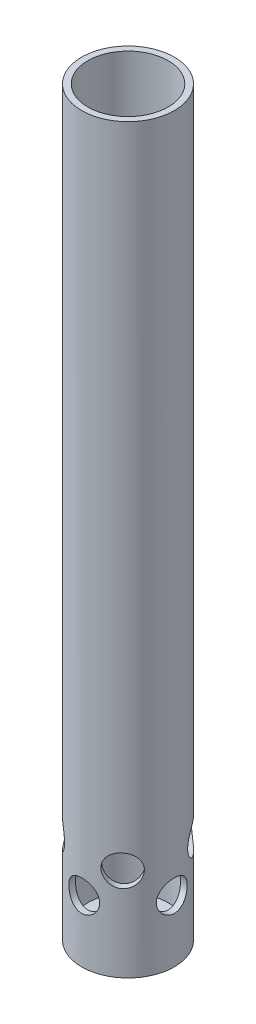
from build123d import *

# Parameters (mm, degrees)
SKETCH1_R           = 9.525
BOSS_EXTRUDE1_DEPTH = 152.4
SKETCH9_R           = 8.255
CUT_EXTRUDE5_DEPTH  = 149.86
SKETCH5_R           = 3.175
CUT_EXTRUDE3_DEPTH  = 3.81
SKETCH7_R           = 3.175
CUT_EXTRUDE4_DEPTH  = 3.81
CIRPATTERN1_COUNT   = 4


with BuildPart() as part:
    # Sketch1 → Boss-Extrude1 (new body)
    with BuildSketch(Plane(origin=(0, 0, 0), x_dir=(1, 0, 0), z_dir=(0, 1, 0))):
        with Locations(Location((0, 0, 0), (0, 0, 270))):
            Circle(SKETCH1_R)
    extrude(amount=-BOSS_EXTRUDE1_DEPTH)

    # Sketch9 → Cut-Extrude5 (cut)
    with BuildSketch(Plane(origin=(0, 0, 0), x_dir=(1, 0, 0), z_dir=(0, 1, 0))):
        with Locations(Location((0, 0, 0), (0, 0, 270))):
            Circle(SKETCH9_R)
    extrude(amount=-CUT_EXTRUDE5_DEPTH, mode=Mode.SUBTRACT)

    # Sketch5 → Cut-Extrude3 (cut)
    with BuildSketch(Plane(origin=(0, -139.7, 9.525), x_dir=(1, 0, 0), z_dir=(0, 0, 1))):
        with Locations(Location((0, 0, 0), (0, 0, 270))):
            Circle(SKETCH5_R)
    cut_extrude3 = extrude(amount=-CUT_EXTRUDE3_DEPTH, mode=Mode.SUBTRACT)

    # Sketch7 → Cut-Extrude4 (cut)
    with BuildSketch(Plane(origin=(6.122551982, -133.35, 7.296573321), x_dir=(0.7660444431189768, 0, -0.642787609686541), z_dir=(0.642787609686541, 0, 0.7660444431189768))):
        Circle(SKETCH7_R)
    cut_extrude4 = extrude(amount=-CUT_EXTRUDE4_DEPTH, mode=Mode.SUBTRACT)

    # CirPattern1: Cut-Extrude3, Cut-Extrude4 ×4 about axis
    cirpattern1_axis = Axis((0, -152.4, 0), (0, 1, 0))
    add([cut_extrude3.rotate(cirpattern1_axis, i * 360 / CIRPATTERN1_COUNT) for i in range(1, CIRPATTERN1_COUNT)], mode=Mode.SUBTRACT)
    add([cut_extrude4.rotate(cirpattern1_axis, i * 360 / CIRPATTERN1_COUNT) for i in range(1, CIRPATTERN1_COUNT)], mode=Mode.SUBTRACT)


solid = part.part
